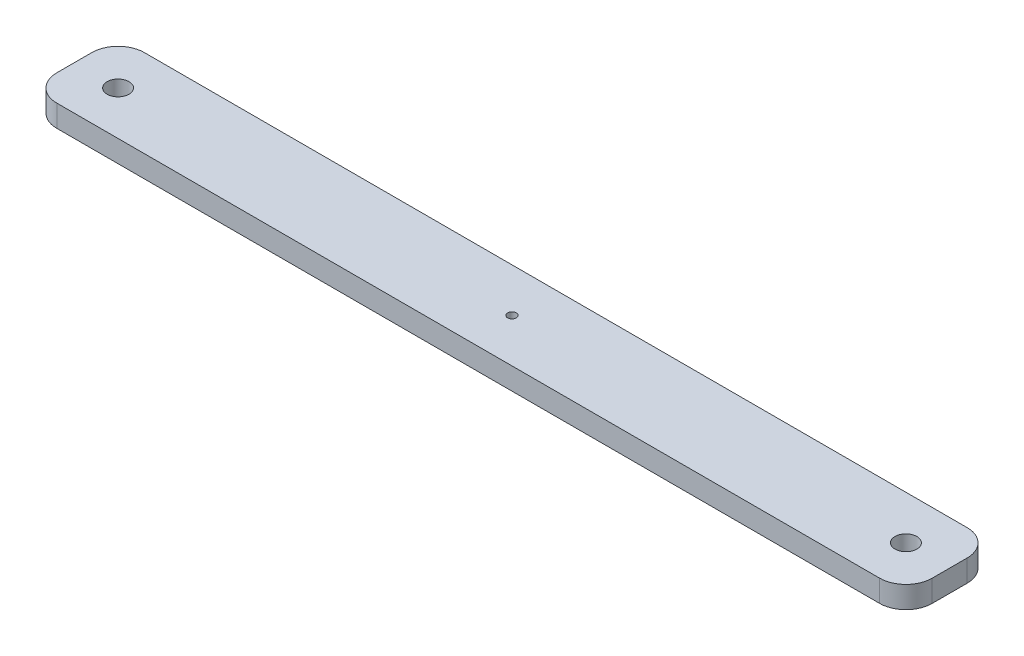
from build123d import *

# Parameters (mm, degrees)
SKETCH1_R           = 3.175
SKETCH1_R_2         = 1.27
BOSS_EXTRUDE1_DEPTH = 6.35


with BuildPart() as part:
    # Sketch1 → Boss-Extrude1 (new body)
    with BuildSketch(Plane(origin=(0, 0, 0), x_dir=(1, 0, 0), z_dir=(0, 1, 0))):
        with BuildLine():
            Line((7.62, 0), (246.38, 0))
            ThreePointArc((246.38, 0), (251.768153673, -2.231846327), (254, -7.62))
            Line((254, -7.62), (254, -17.78))
            ThreePointArc((254, -17.78), (251.768153673, -23.168153673), (246.38, -25.4))
            Line((246.38, -25.4), (7.62, -25.4))
            ThreePointArc((7.62, -25.4), (2.231846327, -23.168153673), (0, -17.78))
            Line((0, -17.78), (0, -7.62))
            ThreePointArc((0, -7.62), (2.231846327, -2.231846327), (7.62, 0))
        make_face()
        with Locations(Location((12.7, -12.7, 0), (0, 0, 270))):
            Circle(SKETCH1_R, mode=Mode.SUBTRACT)
        with Locations(Location((241.3, -12.7, 0), (0, 0, 90))):
            Circle(SKETCH1_R, mode=Mode.SUBTRACT)
        with Locations(Location((127, -12.7, 0), (0, 0, 270))):
            Circle(SKETCH1_R_2, mode=Mode.SUBTRACT)
    extrude(amount=BOSS_EXTRUDE1_DEPTH)


solid = part.part
